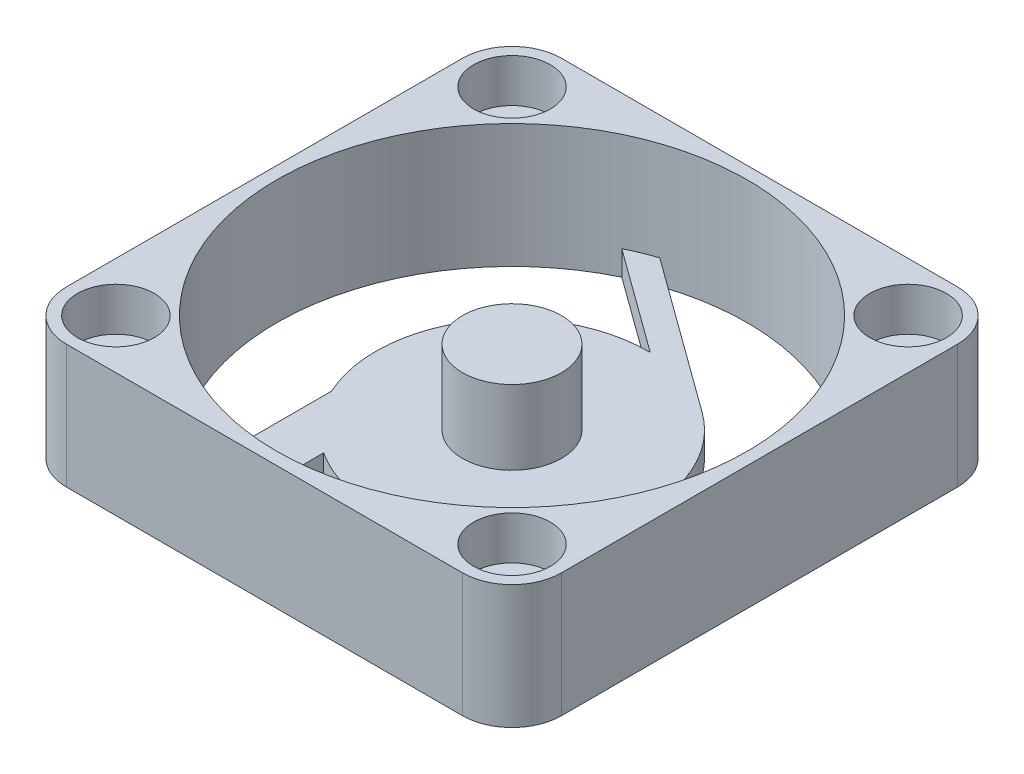
from build123d import *

# Parameters (mm, degrees)
EXTRUDE_1_DEPTH     = 10
SKETCH_2_R          = 19
CUT_EXTRUDE_1_DEPTH = 8
CUT_EXTRUDE_2_DEPTH = 9
SKETCH_4_R          = 1.75
CUT_EXTRUDE_3_DEPTH = 31
SKETCH_5_R          = 3.1
CUT_EXTRUDE_4_DEPTH = 3.5
SKETCH_6_R          = 4
EXTRUDE_2_DEPTH     = 6


with BuildPart() as part:
    # Эскиз1 → Бобышка-Вытянуть1 (new body)
    with BuildSketch(Plane(origin=(0, 0, 0), x_dir=(1, 0, 0), z_dir=(0, 1, 0))):
        with BuildLine():
            Line((16, -20), (-16, -20))
            ThreePointArc((-16, -20), (-18.828427125, -18.828427125), (-20, -16))
            Line((-20, -16), (-20, 16))
            ThreePointArc((-20, 16), (-18.828427125, 18.828427125), (-16, 20))
            Line((-16, 20), (16, 20))
            ThreePointArc((16, 20), (18.828427125, 18.828427125), (20, 16))
            Line((20, 16), (20, -16))
            ThreePointArc((20, -16), (18.828427125, -18.828427125), (16, -20))
        make_face()
    extrude(amount=EXTRUDE_1_DEPTH)

    # Эскиз2 → Вырез-Вытянуть1 (cut)
    with BuildSketch(Plane(origin=(0, 10, 0), x_dir=(1, 0, 0), z_dir=(0, 1, 0))):
        with Locations(Location((0, 0, 0), (0, 0, 270))):
            Circle(SKETCH_2_R)
    extrude(amount=-CUT_EXTRUDE_1_DEPTH, mode=Mode.SUBTRACT)

    # Эскиз3 → Вырез-Вытянуть2 (cut)
    with BuildSketch(Plane(origin=(0, 2, 0), x_dir=(1, 0, 0), z_dir=(0, 1, 0))):
        with BuildLine():
            Line((-10, -4.582575695), (-10, -16.155494421))
            ThreePointArc((-10, -16.155494421), (-18.973695145, 0.999446125), (-8.247376329, 17.116681445))
            Line((-8.247376329, 17.116681445), (0.173394535, 10.998633294))
            ThreePointArc((0.173394535, 10.998633294), (-9.210540816, 6.013812257), (-10, -4.582575695))
        make_face()
        with BuildLine():
            Line((-6, -9.219544457), (-6, -18.027756377))
            ThreePointArc((-6, -18.027756377), (10.378017833, -15.915299113), (18.916407865, -1.780312749))
            Line((18.916407865, -1.780312749), (5.5, -9.526279442))
            ThreePointArc((5.5, -9.526279442), (-0.29329437, -10.996089233), (-6, -9.219544457))
        make_face()
        with BuildLine():
            Line((6.465637775, 8.899186938), (-6.067599609, 18.005116911))
            ThreePointArc((-6.067599609, 18.005116911), (10.850398881, 15.597078064), (18.991376746, 0.572371631))
            Line((18.991376746, 0.572371631), (9.977225575, -4.631950974))
            ThreePointArc((9.977225575, -4.631950974), (10.647293651, 2.763175331), (6.465637775, 8.899186938))
        make_face()
    extrude(amount=-CUT_EXTRUDE_2_DEPTH, mode=Mode.SUBTRACT)

    # Эскиз4 → Вырез-Вытянуть3 (cut, through all)
    with BuildSketch(Plane(origin=(0, 10, 0), x_dir=(1, 0, 0), z_dir=(0, 1, 0))):
        with Locations(Location((-16, 16, 0), (0, 0, 270))):
            Circle(SKETCH_4_R)
        with Locations(Location((16, 16, 0), (0, 0, 270))):
            Circle(SKETCH_4_R)
        with Locations(Location((-16, -16, 0), (0, 0, 270))):
            Circle(SKETCH_4_R)
        with Locations(Location((16, -16, 0), (0, 0, 270))):
            Circle(SKETCH_4_R)
    extrude(amount=-CUT_EXTRUDE_3_DEPTH, mode=Mode.SUBTRACT)

    # Эскиз5 → Вырез-Вытянуть4 (cut)
    with BuildSketch(Plane(origin=(0, 10, 0), x_dir=(1, 0, 0), z_dir=(0, 1, 0))):
        with Locations(Location((-16, 16, 0), (0, 0, 270))):
            Circle(SKETCH_5_R)
        with Locations(Location((16, 16, 0), (0, 0, 270))):
            Circle(SKETCH_5_R)
        with Locations(Location((16, -16, 0), (0, 0, 270))):
            Circle(SKETCH_5_R)
        with Locations(Location((-16, -16, 0), (0, 0, 270))):
            Circle(SKETCH_5_R)
    extrude(amount=-CUT_EXTRUDE_4_DEPTH, mode=Mode.SUBTRACT)

    # Эскиз6 → Бобышка-Вытянуть2 (add)
    with BuildSketch(Plane(origin=(0, 2, 0), x_dir=(1, 0, 0), z_dir=(0, 1, 0))):
        with Locations(Location((0, 0, 0), (0, 0, 270))):
            Circle(SKETCH_6_R)
    extrude(amount=EXTRUDE_2_DEPTH)


solid = part.part
